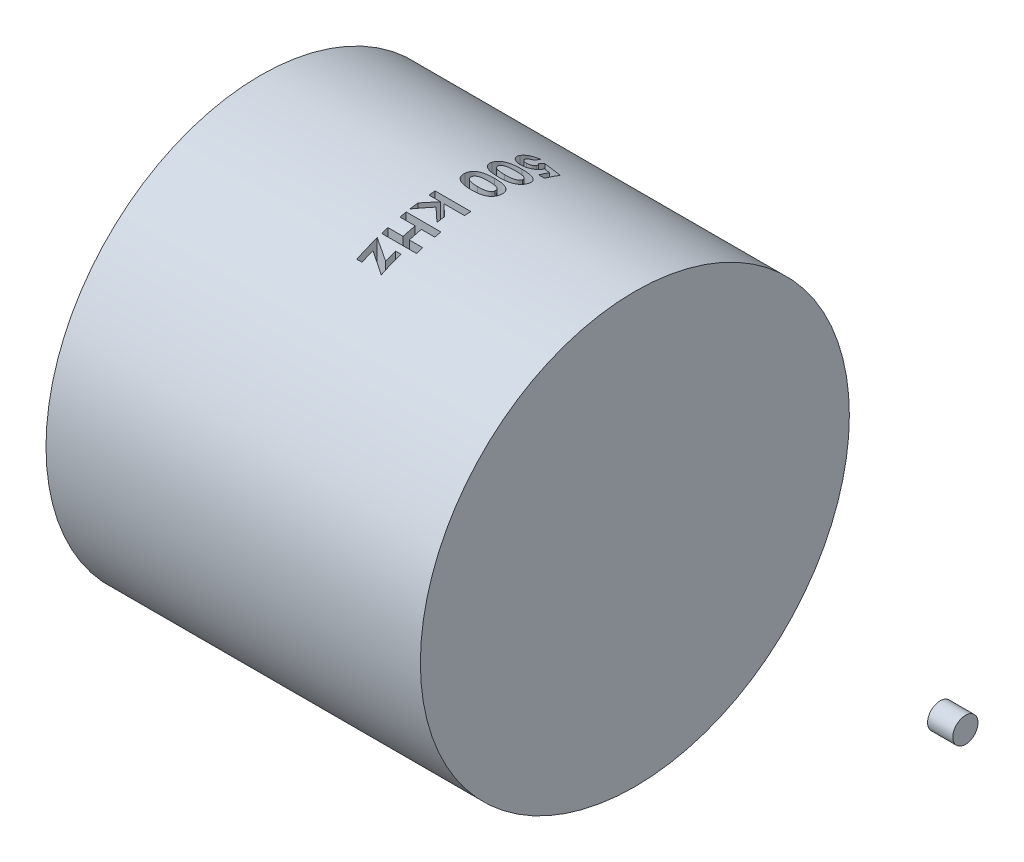
from build123d import *

# Parameters (mm, degrees)
SKETCH1_W          = 37.6809
SKETCH1_H          = 21.59
SKETCH1_W_2        = 2.54
SKETCH1_H_2        = 1.27
CUT_EXTRUDE1_START = 25.4
CUT_EXTRUDE1_DEPTH = 7.62


with BuildPart() as part:
    # Sketch1 → Revolve1 (revolve)
    with BuildSketch(Plane.XY, mode=Mode.PRIVATE) as revolve1_sk:
        with Locations((18.84045, 10.795)):
            Rectangle(SKETCH1_W, SKETCH1_H)
        with Locations((69.680900008, 0.635)):
            Rectangle(SKETCH1_W_2, SKETCH1_H_2)
    revolve(revolve1_sk.sketch.rotate(Axis((0, 0, 0), (1, 0, 0)), 90), axis=Axis((0, 0, 0), (1, 0, 0)))

    # Sketch2 → Cut-Extrude1 (cut)
    # profile 1 of 6: a face of its own
    with BuildSketch(Plane(origin=(0, 0, 0), x_dir=(1, 0, 0), z_dir=(0, 1, 0)).offset(CUT_EXTRUDE1_START)):
        with BuildLine():
            Line((22.34045, 7.830829327), (22.34045, 6.237179487))
            Line((22.34045, 6.237179487), (21.757116667, 6.237179487))
            Line((21.757116667, 6.237179487), (21.757116667, 7.333032853))
            Line((21.757116667, 7.333032853), (21.095257692, 7.469751603))
            add(Edge.make_bspline(
                [(21.095257692, 7.469751603), (21.100461766, 7.451124391), (21.110787098, 7.414166398), (21.120797931, 7.358771532), (21.127642332, 7.305157727), (21.128495062, 7.270185524), (21.128911538, 7.253104968)],
                knots=[0, 0, 0, 0, 1.054652254, 2.092520994, 3.068380062, 4, 4, 4, 4], degree=3))
            add(Edge.make_bspline(
                [(21.128911538, 7.253104968), (21.128058748, 7.21588863), (21.126377709, 7.14252703), (21.11041917, 7.035208318), (21.085284954, 6.932444311), (21.049438378, 6.834549479), (21.002783132, 6.741619453), (20.946343363, 6.653541581), (20.880019942, 6.570207764), (20.803771345, 6.49309836), (20.720048659, 6.42224702), (20.629493716, 6.36064582), (20.53339774, 6.308034551), (20.431163401, 6.266189367), (20.3234328, 6.23316158), (20.2101369, 6.209294964), (20.091141427, 6.195181441), (20.009959324, 6.193278319), (19.968554968, 6.192307692)],
                knots=[0, 0, 0, 0, 1.01440847, 1.999622559, 2.951875003, 3.895578053, 4.836219714, 5.782137149, 6.743708247, 7.735272588, 8.734977101, 9.730283169, 10.717124674, 11.717316708, 12.737475749, 13.78628267, 14.87096371, 16, 16, 16, 16], degree=3))
            add(Edge.make_bspline(
                [(19.968554968, 6.192307692), (19.92667803, 6.193486777), (19.84404259, 6.195813454), (19.722583217, 6.211184537), (19.606010743, 6.237784003), (19.494975629, 6.276158259), (19.388531434, 6.3236231), (19.287398801, 6.382582208), (19.19128445, 6.452016794), (19.101501547, 6.531766972), (19.019424831, 6.618429969), (18.947225241, 6.710714977), (18.886469009, 6.807962464), (18.83736792, 6.910177674), (18.798519955, 7.016773411), (18.770240506, 7.127782229), (18.75402381, 7.243743562), (18.751824361, 7.322466242), (18.75070641, 7.362479968)],
                knots=[0, 0, 0, 0, 1.06812338, 2.107719657, 3.117068656, 4.112431602, 5.099639003, 6.085279307, 7.092884053, 8.119131772, 9.143854758, 10.133578715, 11.102895672, 12.062725997, 13.020721913, 13.992309192, 14.979516593, 16, 16, 16, 16], degree=3))
            add(Edge.make_bspline(
                [(18.75070641, 7.362479968), (18.751620964, 7.398263051), (18.753424655, 7.468834781), (18.764511093, 7.572783839), (18.784112018, 7.673002275), (18.812479632, 7.768958038), (18.847393689, 7.861660743), (18.891060316, 7.95003872), (18.94264804, 8.034577621), (19.001215386, 8.115037387), (19.067189229, 8.190110663), (19.139408967, 8.258629594), (19.216964305, 8.321009003), (19.300812042, 8.375914068), (19.390828295, 8.423172678), (19.485952204, 8.465082578), (19.587177166, 8.499386251), (19.657351933, 8.516794377), (19.693014103, 8.525641026)],
                knots=[0, 0, 0, 0, 1.054957082, 2.080596141, 3.077793124, 4.061112343, 5.027190972, 5.994718051, 6.962465889, 7.943658696, 8.924948258, 9.904494768, 10.875059, 11.855380583, 12.854004648, 13.869083016, 14.917087635, 16, 16, 16, 16], degree=3))
            Line((19.693014103, 8.525641026), (19.693014103, 7.807692308))
            add(Edge.make_bspline(
                [(19.693014103, 7.807692308), (19.668298753, 7.794570416), (19.620267292, 7.769069517), (19.556546066, 7.720522215), (19.501895198, 7.66618931), (19.456818773, 7.605997471), (19.422670926, 7.540802232), (19.396536292, 7.472787835), (19.381744896, 7.400742875), (19.37986223, 7.351559128), (19.378911538, 7.326722756)],
                knots=[0, 0, 0, 0, 1.105084364, 2.147605349, 3.154024051, 4.144789344, 5.108147638, 6.055727127, 7.018198351, 8, 8, 8, 8], degree=3))
            add(Edge.make_bspline(
                [(19.378911538, 7.326722756), (19.379563117, 7.309410581), (19.380845107, 7.275348585), (19.387622003, 7.22516127), (19.400473964, 7.177264351), (19.418214849, 7.131258568), (19.440633474, 7.087007387), (19.468178605, 7.044733715), (19.500676953, 7.004649422), (19.53760222, 6.966888086), (19.578872612, 6.932804817), (19.622928811, 6.902656211), (19.669732437, 6.876865918), (19.719799498, 6.856819164), (19.772573436, 6.840642033), (19.828120684, 6.828658256), (19.886568918, 6.821513501), (19.926467449, 6.820850848), (19.946820192, 6.820512821)],
                knots=[0, 0, 0, 0, 0.978584799, 1.925382083, 2.854237347, 3.773848163, 4.706917643, 5.651871472, 6.619075428, 7.618203006, 8.630937754, 9.638147826, 10.630884984, 11.643619732, 12.679505692, 13.746568031, 14.850495961, 16, 16, 16, 16], degree=3))
            add(Edge.make_bspline(
                [(19.946820192, 6.820512821), (19.966715678, 6.82079648), (20.005470309, 6.821349023), (20.062065906, 6.829165273), (20.11624543, 6.838959651), (20.16750193, 6.854792598), (20.216407954, 6.874109958), (20.261829426, 6.899363869), (20.305848049, 6.92677716), (20.345269713, 6.960162608), (20.381740984, 6.995450007), (20.413582471, 7.033465692), (20.440022491, 7.073741977), (20.463101701, 7.115059349), (20.479899088, 7.159058681), (20.491466614, 7.204752773), (20.49995446, 7.25209299), (20.500453149, 7.284382747), (20.50070641, 7.30078125)],
                knots=[0, 0, 0, 0, 1.166407123, 2.272056916, 3.347877023, 4.393466184, 5.414668253, 6.42708463, 7.438943561, 8.452102724, 9.450960385, 10.414941083, 11.35441816, 12.274885341, 13.186627518, 14.108013686, 15.039145946, 16, 16, 16, 16], degree=3))
            add(Edge.make_bspline(
                [(20.50070641, 7.30078125), (20.500030522, 7.318593834), (20.498675896, 7.354294073), (20.487653668, 7.407335693), (20.469815569, 7.459737778), (20.445205084, 7.511791739), (20.412997724, 7.562980849), (20.375222184, 7.614656014), (20.329133712, 7.665087555), (20.294806913, 7.697153331), (20.277048558, 7.713741987)],
                knots=[0, 0, 0, 0, 0.88288272, 1.769486374, 2.674910571, 3.623812639, 4.617874466, 5.670434592, 6.794841017, 8, 8, 8, 8], degree=3))
            Line((20.277048558, 7.713741987), (20.398342628, 8.242387821))
            Line((20.398342628, 8.242387821), (22.34045, 7.830829327))
        make_face()
    # profile 2 of 6: a face of its own
    with BuildSketch(Plane(origin=(0, 0, 0), x_dir=(1, 0, 0), z_dir=(0, 1, 0)).offset(CUT_EXTRUDE1_START)):
        with BuildLine():
            add(Edge.make_bspline(
                [(22.43019359, 4.565004006), (22.429742236, 4.53459624), (22.428854754, 4.474806446), (22.41924055, 4.38674787), (22.40472042, 4.301921055), (22.384454841, 4.220003752), (22.357688157, 4.14155071), (22.325374891, 4.065929344), (22.286742458, 3.993775612), (22.242351199, 3.924922606), (22.192704725, 3.859049657), (22.135317932, 3.798348226), (22.072732817, 3.740468777), (22.003916306, 3.68637104), (21.928399341, 3.636660696), (21.84718234, 3.590409793), (21.759500821, 3.548214762), (21.665265419, 3.509517404), (21.563047833, 3.474898872), (21.451664164, 3.445822054), (21.331194257, 3.420543514), (21.201010501, 3.400635952), (21.061419987, 3.384342084), (20.912161506, 3.373695851), (20.753652756, 3.366289598), (20.64491315, 3.365691758), (20.589047756, 3.365384615)],
                knots=[0, 0, 0, 0, 0.879087513, 1.728520926, 2.558587148, 3.366762743, 4.166157112, 4.95337177, 5.74258602, 6.530032775, 7.320866164, 8.124307838, 8.942260106, 9.784645725, 10.652593514, 11.554662219, 12.485739241, 13.464770064, 14.499274465, 15.604285219, 16.792026686, 18.057713884, 19.411711354, 20.855437135, 22.384468668, 24, 24, 24, 24], degree=3))
            add(Edge.make_bspline(
                [(20.589047756, 3.365384615), (20.532483771, 3.365718879), (20.422580963, 3.366368348), (20.262617658, 3.373365965), (20.112291986, 3.385416096), (19.971619704, 3.400947472), (19.840674395, 3.422220185), (19.719119388, 3.447136809), (19.606990671, 3.476734576), (19.50456805, 3.512505329), (19.410109208, 3.550872445), (19.322904166, 3.593480028), (19.241386246, 3.637764285), (19.166691474, 3.686409676), (19.098655639, 3.738382357), (19.03665369, 3.792866411), (18.981539362, 3.851022818), (18.932174504, 3.911981846), (18.888963994, 3.977224775), (18.851840259, 4.046464621), (18.821160979, 4.120168591), (18.794717333, 4.197264475), (18.775692411, 4.279123794), (18.760609191, 4.364482614), (18.752270579, 4.454294258), (18.751236357, 4.515442046), (18.75070641, 4.54677484)],
                knots=[0, 0, 0, 0, 1.643682949, 3.193646483, 4.651618242, 6.025629174, 7.305184366, 8.505292942, 9.630500342, 10.672179876, 11.655924581, 12.591484594, 13.491256898, 14.350247848, 15.17884557, 15.977481787, 16.746098769, 17.504475725, 18.254166354, 19.016819136, 19.783753977, 20.571954997, 21.382401421, 22.223156612, 23.089526058, 24, 24, 24, 24], degree=3))
            add(Edge.make_bspline(
                [(18.75070641, 4.54677484), (18.75124886, 4.578106172), (18.752311512, 4.63948379), (18.760521901, 4.729546953), (18.77588352, 4.815550881), (18.794596604, 4.898172018), (18.821303568, 4.976684768), (18.852475309, 5.05166271), (18.889811079, 5.12273257), (18.932829878, 5.189939119), (18.982170926, 5.253038988), (19.037294721, 5.313016471), (19.098064734, 5.369737877), (19.165160754, 5.422340644), (19.237687451, 5.471686046), (19.316472902, 5.51726001), (19.401402715, 5.559033166), (19.492594074, 5.598320083), (19.592015081, 5.632430543), (19.70053357, 5.66289076), (19.819173813, 5.68742464), (19.947490012, 5.708914158), (20.085931839, 5.723343013), (20.233860678, 5.735683277), (20.391733014, 5.742587752), (20.500232862, 5.743249194), (20.556095032, 5.743589744)],
                knots=[0, 0, 0, 0, 0.917197984, 1.796777363, 2.643741708, 3.473481078, 4.273990801, 5.068160217, 5.848535553, 6.620952589, 7.401027954, 8.190319769, 9.003592045, 9.831693788, 10.683727512, 11.569696396, 12.49373307, 13.453184301, 14.474457586, 15.568383184, 16.750575061, 18.019320986, 19.375517054, 20.823796471, 22.364701649, 24, 24, 24, 24], degree=3))
            add(Edge.make_bspline(
                [(20.556095032, 5.743589744), (20.633710909, 5.742980285), (20.783471744, 5.741804327), (20.999863126, 5.727283807), (21.199731241, 5.705318211), (21.383317587, 5.675248997), (21.550262826, 5.634749043), (21.700519005, 5.585046828), (21.835573466, 5.528016868), (21.915593503, 5.479497286), (21.954131891, 5.456129808)],
                knots=[0, 0, 0, 0, 1.288526675, 2.486228817, 3.599112392, 4.626206381, 5.5730174, 6.447949553, 7.252518174, 8, 8, 8, 8], degree=3))
            add(Edge.make_bspline(
                [(21.954131891, 5.456129808), (21.991990942, 5.428953786), (22.066012848, 5.375819308), (22.163189774, 5.282912188), (22.246300239, 5.183095584), (22.31346338, 5.07431932), (22.366428238, 4.958303738), (22.403836721, 4.834052784), (22.425632647, 4.702025298), (22.428650572, 4.61135982), (22.43019359, 4.565004006)],
                knots=[0, 0, 0, 0, 1.058512271, 2.069600068, 3.047294572, 4.004278952, 4.967380941, 5.939006123, 6.946246673, 8, 8, 8, 8], degree=3))
        make_face()
        with BuildLine():
            add(Edge.make_bspline(
                [(21.801988462, 4.549579327), (21.800675557, 4.577063107), (21.798101566, 4.630945906), (21.776618077, 4.709013447), (21.742713792, 4.782298076), (21.702750426, 4.838396942), (21.663761379, 4.880197101), (21.629560775, 4.910492308), (21.589560447, 4.937624758), (21.545489384, 4.963803839), (21.49613472, 4.987096205), (21.4427413, 5.010256934), (21.383526573, 5.029126259), (21.319606529, 5.047709662), (21.249179109, 5.063956349), (21.171690444, 5.077670473), (21.086557861, 5.089496493), (20.993987728, 5.09948217), (20.893611486, 5.105830849), (20.785662834, 5.111974736), (20.669918372, 5.114211341), (20.590215973, 5.114985232), (20.549083814, 5.115384615)],
                knots=[0, 0, 0, 0, 1.076821401, 2.111141558, 3.153197101, 4.23200803, 4.796476379, 5.394298193, 6.020090776, 6.690078086, 7.403703365, 8.159894791, 8.971856079, 9.83973388, 10.771758647, 11.806038152, 12.926526118, 14.143777411, 15.458313878, 16.872423957, 18.385946227, 20, 20, 20, 20], degree=3))
            add(Edge.make_bspline(
                [(20.549083814, 5.115384615), (20.495793729, 5.11474494), (20.393606039, 5.113518315), (20.246661953, 5.107069132), (20.112912209, 5.094216816), (19.991532174, 5.078022657), (19.882982416, 5.055961973), (19.787229237, 5.028493248), (19.703563726, 4.998032088), (19.633216273, 4.959839562), (19.573054762, 4.918919616), (19.521012047, 4.875244024), (19.477659833, 4.82805104), (19.440854668, 4.778751286), (19.413524679, 4.725516515), (19.393600238, 4.669438327), (19.381451834, 4.610392234), (19.379763199, 4.569967478), (19.378911538, 4.549579327)],
                knots=[0, 0, 0, 0, 1.772047989, 3.398033405, 4.888860297, 6.238411839, 7.468309579, 8.567754056, 9.549141588, 10.421774021, 11.221426488, 11.965694757, 12.675067502, 13.348095901, 14.005005053, 14.656328889, 15.322321954, 16, 16, 16, 16], degree=3))
            add(Edge.make_bspline(
                [(19.378911538, 4.549579327), (19.379493617, 4.529890074), (19.380633253, 4.491340964), (19.392331469, 4.435127728), (19.411350227, 4.381968498), (19.438253595, 4.332023778), (19.472465344, 4.285114923), (19.514135815, 4.241471194), (19.563680366, 4.201421744), (19.600449749, 4.178088752), (19.619396314, 4.166065705)],
                knots=[0, 0, 0, 0, 0.992283464, 1.942767638, 2.88273346, 3.832339453, 4.79467288, 5.803907806, 6.868395428, 8, 8, 8, 8], degree=3))
            add(Edge.make_bspline(
                [(19.619396314, 4.166065705), (19.645285324, 4.151906221), (19.699572477, 4.122214931), (19.79119824, 4.087943252), (19.894406805, 4.058706885), (20.010032673, 4.035270218), (20.137611901, 4.016706804), (20.277239309, 4.002515071), (20.429115038, 3.995306613), (20.534353788, 3.99417688), (20.589047756, 3.993589744)],
                knots=[0, 0, 0, 0, 0.710996797, 1.490902623, 2.352723643, 3.296875318, 4.334065587, 5.461510359, 6.680713396, 8, 8, 8, 8], degree=3))
            add(Edge.make_bspline(
                [(20.589047756, 3.993589744), (20.644214798, 3.993820589), (20.750401936, 3.994264927), (20.902846059, 4.002417258), (21.042078485, 4.013769984), (21.167788275, 4.030375801), (21.280280892, 4.05174203), (21.37954804, 4.078076532), (21.465788333, 4.109121256), (21.538906415, 4.145941936), (21.601068753, 4.186706311), (21.654325559, 4.230034454), (21.700175514, 4.276001289), (21.737338851, 4.325102089), (21.766958977, 4.377009179), (21.787144466, 4.432002621), (21.7995619, 4.489899473), (21.80116869, 4.529417533), (21.801988462, 4.549579327)],
                knots=[0, 0, 0, 0, 1.793903324, 3.452957663, 4.963427329, 6.336122014, 7.574844885, 8.684777121, 9.673127442, 10.55010789, 11.340650774, 12.086136756, 12.779466299, 13.446812155, 14.083183996, 14.715685896, 15.34475337, 16, 16, 16, 16], degree=3))
        make_face(mode=Mode.SUBTRACT)
    # profile 3 of 6: a face of its own
    with BuildSketch(Plane(origin=(0, 0, 0), x_dir=(1, 0, 0), z_dir=(0, 1, 0)).offset(CUT_EXTRUDE1_START)):
        with BuildLine():
            add(Edge.make_bspline(
                [(22.43019359, 1.827824519), (22.429742236, 1.797416752), (22.428854754, 1.737626958), (22.41924055, 1.649568383), (22.40472042, 1.564741567), (22.384454841, 1.482824265), (22.357688157, 1.404371222), (22.325374891, 1.328749857), (22.286742458, 1.256596125), (22.242351199, 1.187743119), (22.192704725, 1.12187017), (22.135317932, 1.061168739), (22.072732817, 1.00328929), (22.003916306, 0.949191553), (21.928399341, 0.899481208), (21.84718234, 0.853230306), (21.759500821, 0.811035275), (21.665265419, 0.772337917), (21.563047833, 0.737719385), (21.451664164, 0.708642567), (21.331194257, 0.683364026), (21.201010501, 0.663456465), (21.061419987, 0.647162597), (20.912161506, 0.636516364), (20.753652756, 0.629110111), (20.64491315, 0.628512271), (20.589047756, 0.628205128)],
                knots=[0, 0, 0, 0, 0.879087513, 1.728520926, 2.558587148, 3.366762743, 4.166157112, 4.95337177, 5.74258602, 6.530032775, 7.320866164, 8.124307838, 8.942260106, 9.784645725, 10.652593514, 11.554662219, 12.485739241, 13.464770064, 14.499274465, 15.604285219, 16.792026686, 18.057713884, 19.411711354, 20.855437135, 22.384468668, 24, 24, 24, 24], degree=3))
            add(Edge.make_bspline(
                [(20.589047756, 0.628205128), (20.532483771, 0.628539392), (20.422580963, 0.629188861), (20.262617658, 0.636186478), (20.112291986, 0.648236609), (19.971619704, 0.663767985), (19.840674395, 0.685040698), (19.719119388, 0.709957322), (19.606990671, 0.739555089), (19.50456805, 0.775325841), (19.410109208, 0.813692957), (19.322904166, 0.856300541), (19.241386246, 0.900584798), (19.166691474, 0.949230188), (19.098655639, 1.00120287), (19.03665369, 1.055686924), (18.981539362, 1.11384333), (18.932174504, 1.174802359), (18.888963994, 1.240045288), (18.851840259, 1.309285134), (18.821160979, 1.382989104), (18.794717333, 1.460084987), (18.775692411, 1.541944307), (18.760609191, 1.627303127), (18.752270579, 1.717114771), (18.751236357, 1.778262559), (18.75070641, 1.809595353)],
                knots=[0, 0, 0, 0, 1.643682949, 3.193646483, 4.651618242, 6.025629174, 7.305184366, 8.505292942, 9.630500342, 10.672179876, 11.655924581, 12.591484594, 13.491256898, 14.350247848, 15.17884557, 15.977481787, 16.746098769, 17.504475725, 18.254166354, 19.016819136, 19.783753977, 20.571954997, 21.382401421, 22.223156612, 23.089526058, 24, 24, 24, 24], degree=3))
            add(Edge.make_bspline(
                [(18.75070641, 1.809595353), (18.75124886, 1.840926685), (18.752311512, 1.902304303), (18.760521901, 1.992367466), (18.77588352, 2.078371394), (18.794596604, 2.160992531), (18.821303568, 2.239505281), (18.852475309, 2.314483223), (18.889811079, 2.385553082), (18.932829878, 2.452759632), (18.982170926, 2.515859501), (19.037294721, 2.575836984), (19.098064734, 2.63255839), (19.165160754, 2.685161156), (19.237687451, 2.734506559), (19.316472902, 2.780080523), (19.401402715, 2.821853679), (19.492594074, 2.861140596), (19.592015081, 2.895251056), (19.70053357, 2.925711272), (19.819173813, 2.950245153), (19.947490012, 2.971734671), (20.085931839, 2.986163526), (20.233860678, 2.99850379), (20.391733014, 3.005408265), (20.500232862, 3.006069707), (20.556095032, 3.006410256)],
                knots=[0, 0, 0, 0, 0.917197984, 1.796777363, 2.643741708, 3.473481078, 4.273990801, 5.068160217, 5.848535553, 6.620952589, 7.401027954, 8.190319769, 9.003592045, 9.831693788, 10.683727512, 11.569696396, 12.49373307, 13.453184301, 14.474457586, 15.568383184, 16.750575061, 18.019320986, 19.375517054, 20.823796471, 22.364701649, 24, 24, 24, 24], degree=3))
            add(Edge.make_bspline(
                [(20.556095032, 3.006410256), (20.633710909, 3.005800798), (20.783471744, 3.00462484), (20.999863126, 2.99010432), (21.199731241, 2.968138723), (21.383317587, 2.93806951), (21.550262826, 2.897569555), (21.700519005, 2.847867341), (21.835573466, 2.790837381), (21.915593503, 2.742317799), (21.954131891, 2.718950321)],
                knots=[0, 0, 0, 0, 1.288526675, 2.486228817, 3.599112392, 4.626206381, 5.5730174, 6.447949553, 7.252518174, 8, 8, 8, 8], degree=3))
            add(Edge.make_bspline(
                [(21.954131891, 2.718950321), (21.991990942, 2.691774299), (22.066012848, 2.638639821), (22.163189774, 2.545732701), (22.246300239, 2.445916097), (22.31346338, 2.337139833), (22.366428238, 2.22112425), (22.403836721, 2.096873297), (22.425632647, 1.96484581), (22.428650572, 1.874180333), (22.43019359, 1.827824519)],
                knots=[0, 0, 0, 0, 1.058512271, 2.069600068, 3.047294572, 4.004278952, 4.967380941, 5.939006123, 6.946246673, 8, 8, 8, 8], degree=3))
        make_face()
        with BuildLine():
            add(Edge.make_bspline(
                [(21.801988462, 1.81239984), (21.800675557, 1.83988362), (21.798101566, 1.893766419), (21.776618077, 1.97183396), (21.742713792, 2.045118589), (21.702750426, 2.101217454), (21.663761379, 2.143017614), (21.629560775, 2.173312821), (21.589560447, 2.200445271), (21.545489384, 2.226624352), (21.49613472, 2.249916718), (21.4427413, 2.273077446), (21.383526573, 2.291946772), (21.319606529, 2.310530175), (21.249179109, 2.326776862), (21.171690444, 2.340490986), (21.086557861, 2.352317005), (20.993987728, 2.362302683), (20.893611486, 2.368651362), (20.785662834, 2.374795249), (20.669918372, 2.377031854), (20.590215973, 2.377805745), (20.549083814, 2.378205128)],
                knots=[0, 0, 0, 0, 1.076821401, 2.111141558, 3.153197101, 4.23200803, 4.796476379, 5.394298193, 6.020090776, 6.690078086, 7.403703365, 8.159894791, 8.971856079, 9.83973388, 10.771758647, 11.806038152, 12.926526118, 14.143777411, 15.458313878, 16.872423957, 18.385946227, 20, 20, 20, 20], degree=3))
            add(Edge.make_bspline(
                [(20.549083814, 2.378205128), (20.495793729, 2.377565453), (20.393606039, 2.376338828), (20.246661953, 2.369889645), (20.112912209, 2.357037329), (19.991532174, 2.34084317), (19.882982416, 2.318782486), (19.787229237, 2.29131376), (19.703563726, 2.260852601), (19.633216273, 2.222660075), (19.573054762, 2.181740129), (19.521012047, 2.138064537), (19.477659833, 2.090871553), (19.440854668, 2.041571798), (19.413524679, 1.988337028), (19.393600238, 1.932258839), (19.381451834, 1.873212747), (19.379763199, 1.832787991), (19.378911538, 1.81239984)],
                knots=[0, 0, 0, 0, 1.772047989, 3.398033405, 4.888860297, 6.238411839, 7.468309579, 8.567754056, 9.549141588, 10.421774021, 11.221426488, 11.965694757, 12.675067502, 13.348095901, 14.005005053, 14.656328889, 15.322321954, 16, 16, 16, 16], degree=3))
            add(Edge.make_bspline(
                [(19.378911538, 1.81239984), (19.379493617, 1.792710586), (19.380633253, 1.754161477), (19.392331469, 1.697948241), (19.411350227, 1.644789011), (19.438253595, 1.594844291), (19.472465344, 1.547935436), (19.514135815, 1.504291707), (19.563680366, 1.464242257), (19.600449749, 1.440909265), (19.619396314, 1.428886218)],
                knots=[0, 0, 0, 0, 0.992283464, 1.942767638, 2.88273346, 3.832339453, 4.79467288, 5.803907806, 6.868395428, 8, 8, 8, 8], degree=3))
            add(Edge.make_bspline(
                [(19.619396314, 1.428886218), (19.645285324, 1.414726734), (19.699572477, 1.385035444), (19.79119824, 1.350763765), (19.894406805, 1.321527398), (20.010032673, 1.298090731), (20.137611901, 1.279527317), (20.277239309, 1.265335584), (20.429115038, 1.258127125), (20.534353788, 1.256997393), (20.589047756, 1.256410256)],
                knots=[0, 0, 0, 0, 0.710996797, 1.490902623, 2.352723643, 3.296875318, 4.334065587, 5.461510359, 6.680713396, 8, 8, 8, 8], degree=3))
            add(Edge.make_bspline(
                [(20.589047756, 1.256410256), (20.644214798, 1.256641102), (20.750401936, 1.25708544), (20.902846059, 1.26523777), (21.042078485, 1.276590497), (21.167788275, 1.293196314), (21.280280892, 1.314562543), (21.37954804, 1.340897045), (21.465788333, 1.371941768), (21.538906415, 1.408762449), (21.601068753, 1.449526824), (21.654325559, 1.492854967), (21.700175514, 1.538821802), (21.737338851, 1.587922601), (21.766958977, 1.639829692), (21.787144466, 1.694823133), (21.7995619, 1.752719986), (21.80116869, 1.792238046), (21.801988462, 1.81239984)],
                knots=[0, 0, 0, 0, 1.793903324, 3.452957663, 4.963427329, 6.336122014, 7.574844885, 8.684777121, 9.673127442, 10.55010789, 11.340650774, 12.086136756, 12.779466299, 13.446812155, 14.083183996, 14.715685896, 15.34475337, 16, 16, 16, 16], degree=3))
        make_face(mode=Mode.SUBTRACT)
    # profile 4 of 6: a face of its own
    with BuildSketch(Plane(origin=(0, 0, 0), x_dir=(1, 0, 0), z_dir=(0, 1, 0)).offset(CUT_EXTRUDE1_START)):
        Polygon((22.43019359, -1.256410256), (22.43019359, -1.884615385), (20.33664391, -1.884615385), (21.398142308, -2.861979167), (21.398142308, -3.638120994), (20.178891506, -2.515625), (18.84045, -3.798677885), (18.84045, -3.0078125), (20.012024519, -1.884615385), (18.84045, -1.884615385), (18.84045, -1.256410256), align=None)
    # profile 5 of 6: a face of its own
    with BuildSketch(Plane(origin=(0, 0, 0), x_dir=(1, 0, 0), z_dir=(0, 1, 0)).offset(CUT_EXTRUDE1_START)):
        Polygon((22.34045, -4.173076923), (22.34045, -4.801282051), (20.994296154, -4.801282051), (20.994296154, -6.012820513), (22.34045, -6.012820513), (22.34045, -6.641025641), (18.84045, -6.641025641), (18.84045, -6.012820513), (20.366091026, -6.012820513), (20.366091026, -4.801282051), (18.84045, -4.801282051), (18.84045, -4.173076923), align=None)
    # profile 6 of 6: a face of its own
    with BuildSketch(Plane(origin=(0, 0, 0), x_dir=(1, 0, 0), z_dir=(0, 1, 0)).offset(CUT_EXTRUDE1_START)):
        Polygon((21.398142308, -7.269230769), (21.398142308, -9.243589744), (19.378911538, -8.067107372), (19.378911538, -9.153846154), (18.84045, -9.153846154), (18.84045, -7.08974359), (20.859680769, -8.266225962), (20.859680769, -7.269230769), align=None)
    extrude(amount=-CUT_EXTRUDE1_DEPTH, mode=Mode.SUBTRACT)


solid = part.part
